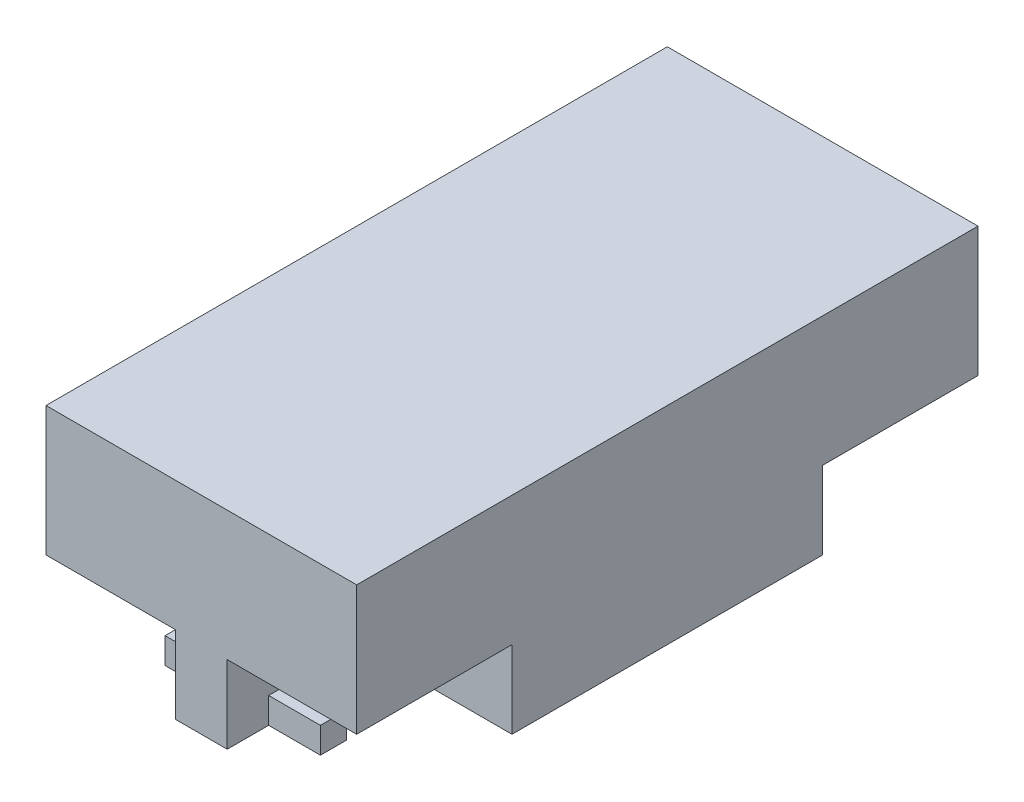
from build123d import *

# Parameters (mm, degrees)
BOSS_EXTRUDE1_DEPTH      = 150
BOSS_EXTRUDE1_DEPTH_BACK = 150
SKETCH2_W                = 600
SKETCH2_H                = 200
SKETCH3_W                = 150
SKETCH3_H                = 75
CUT_EXTRUDE1_DEPTH       = 125
SKETCH4_W                = 25
SKETCH4_H                = 25
BOSS_EXTRUDE2_DEPTH      = 50
MIRROR3_COPY_1_SKETCH_W  = 25
MIRROR3_COPY_1_SKETCH_H  = 25
MIRROR3_COPY_1_DEPTH     = 50
MIRROR3_COPY_2_SKETCH_W  = 25
MIRROR3_COPY_2_SKETCH_H  = 25
MIRROR3_COPY_2_DEPTH     = 50


with BuildPart() as part:
    # Sketch2 → Boss-Extrude1 (new, two sides: drawn at the far end of the back side and taken through both)
    with BuildSketch(Plane(origin=(0, 0, 0), x_dir=(0, 0, -1), z_dir=(1, 0, 0)).offset(-BOSS_EXTRUDE1_DEPTH_BACK)):
        Rectangle(SKETCH2_W, SKETCH2_H)
    extrude(amount=BOSS_EXTRUDE1_DEPTH + BOSS_EXTRUDE1_DEPTH_BACK)

    # Sketch3 → Cut-Extrude1 (cut)
    with BuildSketch(Plane(origin=(150, 0, 0), x_dir=(0, 0, -1), z_dir=(1, 0, 0))):
        with Locations((-225, -62.5)):
            Rectangle(SKETCH3_W, SKETCH3_H)
        with Locations((225, -62.5)):
            Rectangle(SKETCH3_W, SKETCH3_H)
    cut_extrude1 = extrude(amount=-CUT_EXTRUDE1_DEPTH, mode=Mode.SUBTRACT)

    # Mirror1: Cut-Extrude1 across plane
    add(cut_extrude1.mirror(Plane(origin=(0, 0, 0), x_dir=(0, 0, 1), z_dir=(1, 0, 0))), mode=Mode.SUBTRACT)

    # Sketch4 → Boss-Extrude2 (add)
    with BuildSketch(Plane(origin=(25, 0, 0), x_dir=(0, 0, -1), z_dir=(1, 0, 0))):
        with Locations((-247.5, -87.5)):
            Rectangle(SKETCH4_W, SKETCH4_H)
    boss_extrude2 = extrude(amount=BOSS_EXTRUDE2_DEPTH)

    # Mirror2: Boss-Extrude2 across plane
    add(boss_extrude2.mirror(Plane(origin=(0, 0, 0), x_dir=(0, 0, 1), z_dir=(1, 0, 0))))

    # Mirror3 copy 1 sketch → Mirror3 copy 1 (add)
    with BuildSketch(Plane.ZY.offset(25)):
        with Locations((-247.5, -87.5)):
            Rectangle(MIRROR3_COPY_1_SKETCH_W, MIRROR3_COPY_1_SKETCH_H)
    extrude(amount=MIRROR3_COPY_1_DEPTH)

    # Mirror3 copy 2 sketch → Mirror3 copy 2 (add)
    with BuildSketch(Plane(origin=(25, 0, 0), x_dir=(0, 0, 1), z_dir=(1, 0, 0))):
        with Locations((-247.5, 87.5)):
            Rectangle(MIRROR3_COPY_2_SKETCH_W, MIRROR3_COPY_2_SKETCH_H)
    extrude(amount=MIRROR3_COPY_2_DEPTH)


solid = part.part
